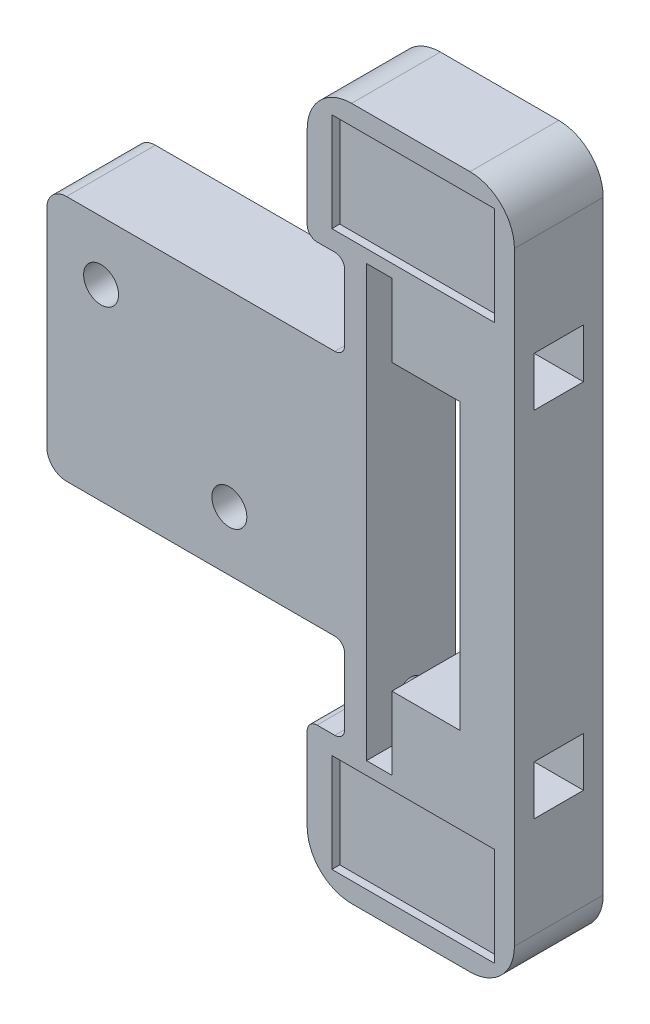
from build123d import *
from OCP.BRepAlgoAPI import BRepAlgoAPI_Cut
from OCP.TopTools import TopTools_ListOfShape

# Parameters (mm, degrees)
BOSS_EXTRUDE2_DEPTH = 11.43
SKETCH4_W           = 20.955
SKETCH4_H           = 12.7
CUT_EXTRUDE2_DEPTH  = 1.016
SKETCH5_R           = 2.25
CUT_EXTRUDE3_DEPTH  = 66.915251214
SKETCH6_R           = 1.524
CUT_EXTRUDE4_DEPTH  = 76.777894678
SKETCH7_W           = 11.43
SKETCH7_H           = 11.049
CUT_EXTRUDE5_DEPTH  = 4.826
SKETCH8_W           = 6.35
SKETCH8_H           = 6.35
CUT_EXTRUDE6_DEPTH  = 12.914
SKETCH9_R           = 5.715
CUT_EXTRUDE7_DEPTH  = 5.548
CUT_EXTRUDE8_DEPTH  = 66.915251214
FILLET1_R           = 1.27
FILLET2_R           = 2.54
FILLET3_R           = 5.715


with BuildPart() as part:
    # Sketch1 → Boss-Extrude2 (new body)
    with BuildSketch(Plane.XY):
        Polygon((13.0175, 0), (13.0175, 44.6024), (-13.6525, 44.6024), (-13.6525, 15.875), (-47.1678, 15.875), (-47.1678, 0), (-47.1678, -15.875), (-13.6525, -15.875), (-13.6525, -44.6024), (13.0175, -44.6024), align=None)
        Polygon((-5.7658, 27.4574), (-5.7658, -27.4574), (-2.997199182, -27.4574), (-2.997199182, -18.0721), (5.7658, -18.0721), (5.7658, 18.0721), (-2.997199182, 18.0721), (-2.997199182, 27.4574), align=None, mode=Mode.SUBTRACT)
    extrude(amount=BOSS_EXTRUDE2_DEPTH)

    # Sketch4 → Cut-Extrude2 (cut)
    with BuildSketch(Plane.XY.offset(11.43)):
        with Locations((0, 35.7124)):
            Rectangle(SKETCH4_W, SKETCH4_H)
        with Locations((0, -35.7124)):
            Rectangle(SKETCH4_W, SKETCH4_H)
    extrude(amount=-CUT_EXTRUDE2_DEPTH, mode=Mode.SUBTRACT)

    # Sketch5 → Cut-Extrude3 (cut, through all)
    with BuildSketch(Plane.XY.offset(11.43)):
        with Locations((-40.1828, 8.255)):
            Circle(SKETCH5_R)
        with Locations((-23.6728, -8.255)):
            Circle(SKETCH5_R)
    extrude(amount=-CUT_EXTRUDE3_DEPTH, mode=Mode.SUBTRACT)

    # Sketch6 → Cut-Extrude4 (cut, through all)
    with BuildSketch(Plane(origin=(13.0175, 0, 0), x_dir=(0, 0, -1), z_dir=(1, 0, 0))):
        with Locations((-5.715, 22.767528581)):
            Circle(SKETCH6_R)
        with Locations((-5.715, -22.767528581)):
            Circle(SKETCH6_R)
    extrude(amount=-CUT_EXTRUDE4_DEPTH, mode=Mode.SUBTRACT)

    # Sketch7 → Cut-Extrude5 (cut)
    with BuildSketch(Plane.ZY.offset(13.6525)):
        with Locations((5.715, 21.3995)):
            Rectangle(SKETCH7_W, SKETCH7_H)
        with Locations((5.715, -21.3995)):
            Rectangle(SKETCH7_W, SKETCH7_H)
    extrude(amount=-CUT_EXTRUDE5_DEPTH, mode=Mode.SUBTRACT)

    # Sketch8 → Cut-Extrude6 (cut)
    with BuildSketch(Plane(origin=(13.0175, 0, 0), x_dir=(0, 0, -1), z_dir=(1, 0, 0))):
        with Locations((-5.715, -22.767528581)):
            Rectangle(SKETCH8_W, SKETCH8_H)
        with Locations((-5.715, 22.767528581)):
            Rectangle(SKETCH8_W, SKETCH8_H)
    extrude(amount=-CUT_EXTRUDE6_DEPTH, mode=Mode.SUBTRACT)

    # Sketch9 → Cut-Extrude7 (cut)
    with BuildSketch(Plane.XY):
        with Locations((-40.1828, 8.255)):
            Circle(SKETCH9_R)
        with Locations((-23.6728, -8.255)):
            Circle(SKETCH9_R)
    extrude(amount=CUT_EXTRUDE7_DEPTH, mode=Mode.SUBTRACT)


with BuildPart() as cut_extrude8_tool:
    # Sketch10 → Cut-Extrude8 (new, through all)
    with BuildSketch(Plane.XY.offset(11.43)):
        Polygon((-2.747199182, 27.7074), (-6.015799182, 27.7074), (-6.015799182, -27.7074), (-2.747199182, -27.7074), (-2.747199182, -18.3221), (6.015800818, -18.3221), (6.015800818, 18.3221), (-2.747199182, 18.3221), align=None)
        Polygon((-2.997199182, 27.4574), (-5.765799182, 27.4574), (-5.765799182, -27.4574), (-2.997199182, -27.4574), (-2.997199182, -18.0721), (5.7658, -18.0721), (5.765800818, 18.0721), (-2.997199182, 18.0721), align=None, mode=Mode.SUBTRACT)
    extrude(amount=-CUT_EXTRUDE8_DEPTH)


with BuildPart() as part_1:
    add(part.part)

    # Cut-Extrude8: cut by cut_extrude8_tool, with a tolerance
    cut_extrude8_stock = TopTools_ListOfShape()
    cut_extrude8_stock.Append(part_1.part.wrapped)
    cut_extrude8_tools = TopTools_ListOfShape()
    cut_extrude8_tools.Append(cut_extrude8_tool.part.wrapped)
    cut_extrude8_cut = BRepAlgoAPI_Cut()
    cut_extrude8_cut.SetArguments(cut_extrude8_stock)
    cut_extrude8_cut.SetTools(cut_extrude8_tools)
    cut_extrude8_cut.SetFuzzyValue(0.00001)
    cut_extrude8_cut.Build()
    add(Compound.cast(cut_extrude8_cut.Shape()).solids(), mode=Mode.REPLACE)

    # Fillet1
    fillet1_edges = [part_1.edges().sort_by_distance(p)[0] for p in [
        (-13.6525, 26.924, 5.715),
        (-13.6525, -26.924, 5.715),
        (-8.8265, -26.924, 5.715),
        (-8.8265, -15.875, 5.715),
        (-8.8265, 15.875, 5.715),
        (-8.8265, 26.924, 5.715),
    ]]
    fillet(fillet1_edges, radius=FILLET1_R)

    # Fillet2
    fillet2_edges = [part_1.edges().sort_by_distance(p)[0] for p in [
        (-47.1678, -15.875, 5.715),
        (-47.1678, 15.875, 5.715),
    ]]
    fillet(fillet2_edges, radius=FILLET2_R)

    # Fillet3
    fillet3_edges = [part_1.edges().sort_by_distance(p)[0] for p in [
        (-13.6525, -44.6024, 5.715),
        (13.0175, -44.6024, 5.715),
        (13.0175, 44.6024, 5.715),
        (-13.6525, 44.6024, 5.715),
    ]]
    fillet(fillet3_edges, radius=FILLET3_R)


solid = part_1.part
